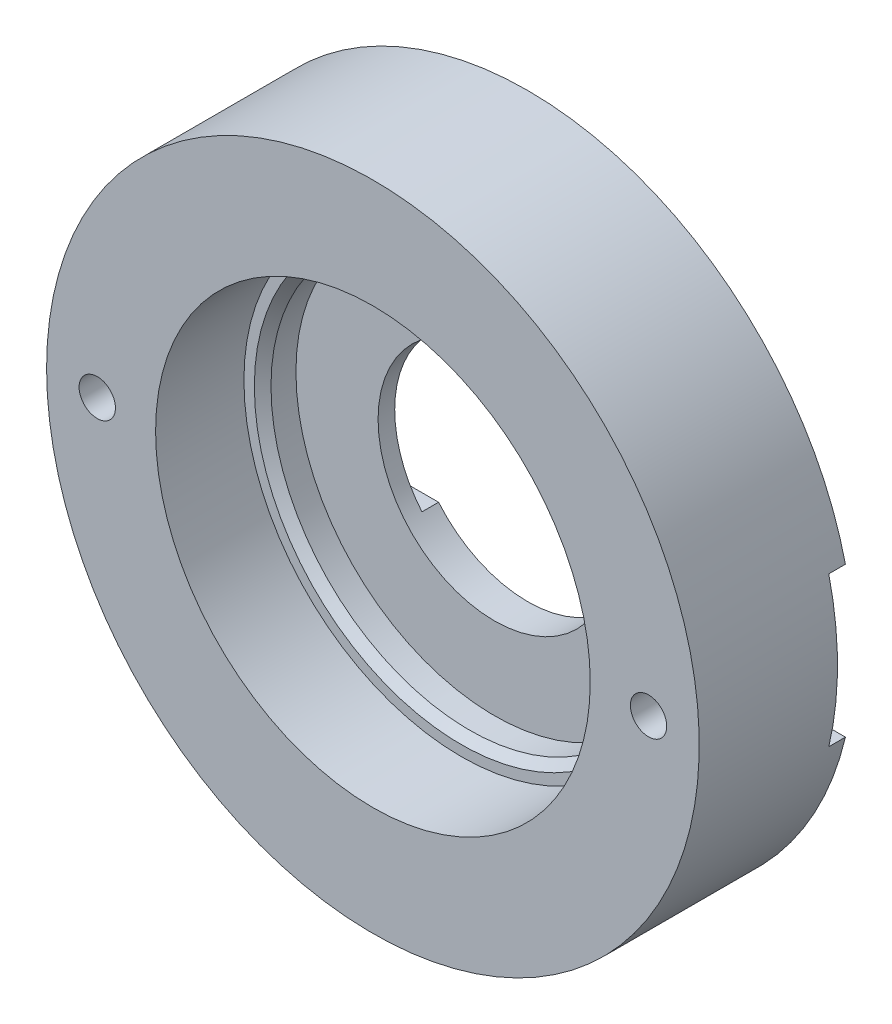
from build123d import *

# Parameters (mm, degrees)
SKETCH1_W          = 12.617819502
SKETCH1_H          = 2
SKETCH1_W_2        = 6.5532
SKETCH1_H_2        = 5.31
SKETCH2_R          = 1.0922
CUT_EXTRUDE1_DEPTH = 30.264206533
SKETCH3_W          = 45.123892984
SKETCH3_H          = 9
CUT_EXTRUDE2_DEPTH = 1
CHAMFER1_SIZE      = 0.5


with BuildPart() as part:
    # Sketch1 → Revolve1 (revolve)
    with BuildSketch(Plane(origin=(0, 0, 0), x_dir=(1, 0, 0), z_dir=(0, 1, 0))):
        with Locations((-13.308909751, 2.525473465)):
            Rectangle(SKETCH1_W, SKETCH1_H)
        Polygon((-11.938, 1.525473465), (-19.617819502, 1.525473465), (-19.617819502, -0.474526535), (-13.064619502, -0.474526535), (-11.938, -0.474526535), align=None)
        with Locations((-16.341219502, -3.129526535)):
            Rectangle(SKETCH1_W_2, SKETCH1_H_2)
    revolve(axis=Axis((0, 0, -25.411285606), (0, 0, 1)))

    # Sketch2 → Cut-Extrude1 (cut, through all)
    with BuildSketch(Plane(origin=(0, 0, -3.525473465), x_dir=(-1, 0, 0), z_dir=(0, 0, -1))):
        with Locations((16.57, 0)):
            Circle(SKETCH2_R)
        with Locations(Location((-16.57, 0, 0), (0, 0, 180))):
            Circle(SKETCH2_R)
    extrude(amount=-CUT_EXTRUDE1_DEPTH, mode=Mode.SUBTRACT)

    # Sketch3 → Cut-Extrude2 (cut)
    with BuildSketch(Plane(origin=(0, 0, -3.525473465), x_dir=(-1, 0, 0), z_dir=(0, 0, -1))):
        Rectangle(SKETCH3_W, SKETCH3_H)
    extrude(amount=-CUT_EXTRUDE2_DEPTH, mode=Mode.SUBTRACT)

    # Chamfer1
    chamfer1_edges = [part.edges().sort_by_distance(p)[0] for p in [
        (11.938, 0, 0.474526535),
    ]]
    chamfer(chamfer1_edges, length=CHAMFER1_SIZE)


solid = part.part
